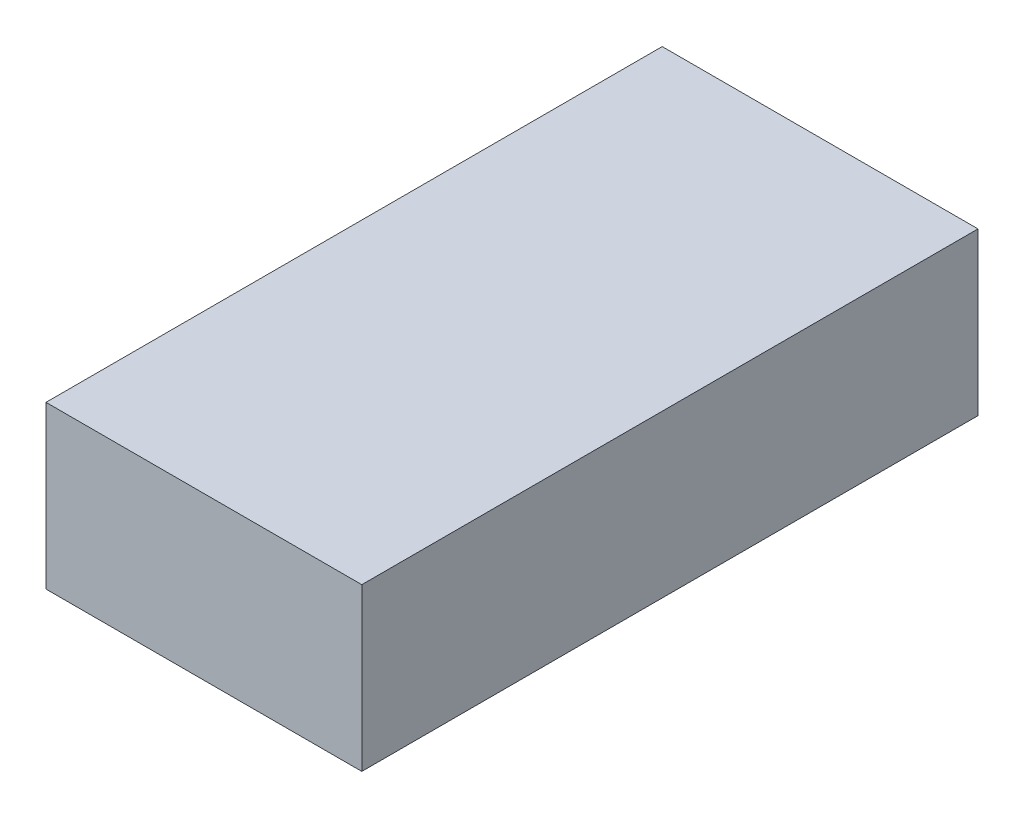
from build123d import *

# Parameters (mm, degrees)
SKETCH1_W           = 41
SKETCH1_H           = 21
BOSS_EXTRUDE1_DEPTH = 80


with BuildPart() as part:
    # Sketch1 → Boss-Extrude1 (new body)
    with BuildSketch(Plane.XY):
        Rectangle(SKETCH1_W, SKETCH1_H)
    extrude(amount=BOSS_EXTRUDE1_DEPTH)


solid = part.part
